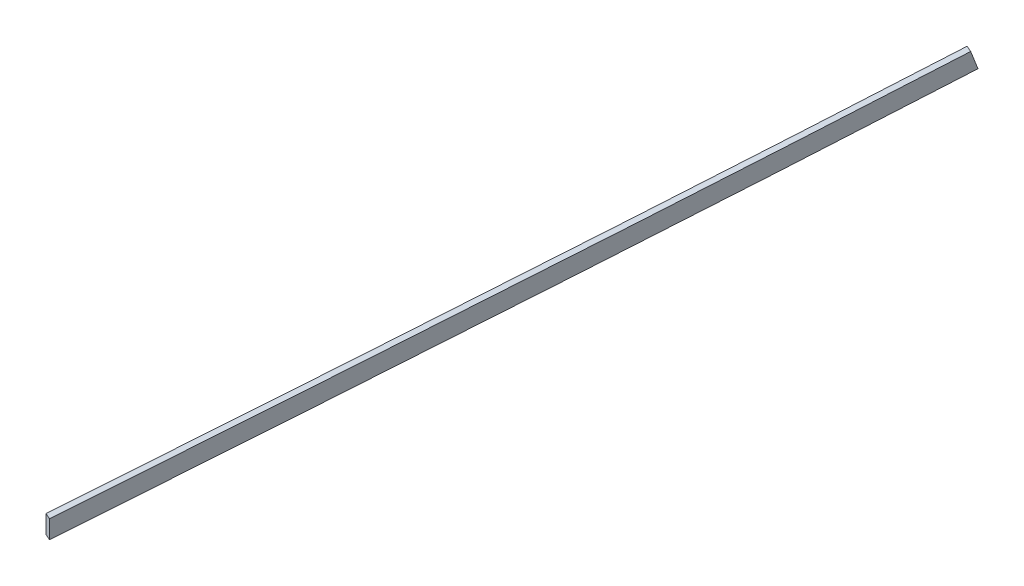
from build123d import *

# Parameters (mm, degrees)
BOSS_EXTRUDE1_DEPTH = 2.54
CUT_EXTRUDE1_DEPTH  = 461.996688174


with BuildPart() as part:
    # Sketch1 → Boss-Extrude1 (new body)
    with BuildSketch(Plane(origin=(190.505997168, 0, 85.025834525), x_dir=(-0.40756496353562105, 0, 0.9131762154689576), z_dir=(-0.9131762154689574, 0, -0.407564963535621))):
        with BuildLine():
            Line((-451.191881748, -3.434173171), (-449.145562546, 2.577072767))
            add(Edge.make_bspline(
                [(-449.145562546, 2.577072767), (-427.226627008, -4.884465015), (-383.327200903, -19.615616926), (-317.323301525, -41.314363199), (-251.218228642, -62.720009507), (-207.093072223, -76.838137693), (-185.022096982, -83.868371447)],
                knots=[0, 0, 0, 0, 0.25, 0.5, 0.75, 1, 1, 1, 1], degree=3))
            Line((-185.022096982, -83.868371447), (-186.949344643, -89.918843863))
            add(Edge.make_bspline(
                [(-451.191881748, -3.434173171), (-429.257779366, -10.900873976), (-407.29166076, -18.271783438), (-363.314535035, -32.879297619), (-341.303290696, -40.115568889), (-275.221574147, -61.675844595), (-231.103607286, -75.85445458), (-186.949344643, -89.918843863)],
                knots=[0, 0, 0, 0, 0.25, 0.25, 0.5, 0.5, 1, 1, 1, 1], degree=3))
        make_face()
    extrude(amount=BOSS_EXTRUDE1_DEPTH)

    # Sketch2 → Cut-Extrude1 (cut, through all)
    with BuildSketch(Plane(origin=(188.18652958, 0, 83.990619518), x_dir=(-0.4075649635356864, -6.063035894240441e-13, 0.9131762154689282), z_dir=(-0.9131762154689284, -2.1508590946736572e-13, -0.40756496353568644))):
        with BuildLine():
            Line((-192.640382381, -81.440462715), (-192.640382385, -88.105382717))
            add(Edge.make_bspline(
                [(-192.640382385, -88.105382717), (-190.743438243, -88.710084881), (-188.846424944, -89.314569796), (-186.949344643, -89.918843863)],
                knots=[0.978517586, 0.978517586, 0.978517586, 0.978517586, 1, 1, 1, 1], degree=3))
            Line((-186.949344643, -89.918843863), (-185.022096982, -83.868371447))
            add(Edge.make_bspline(
                [(-185.022096982, -83.868371447), (-187.561639352, -83.059454927), (-190.10107055, -82.250156711), (-192.640382381, -81.440462715)],
                knots=[0, 0, 0, 0, 0.028765634, 0.028765634, 0.028765634, 0.028765634], degree=3))
        make_face()
    extrude(amount=-CUT_EXTRUDE1_DEPTH, mode=Mode.SUBTRACT)


solid = part.part
